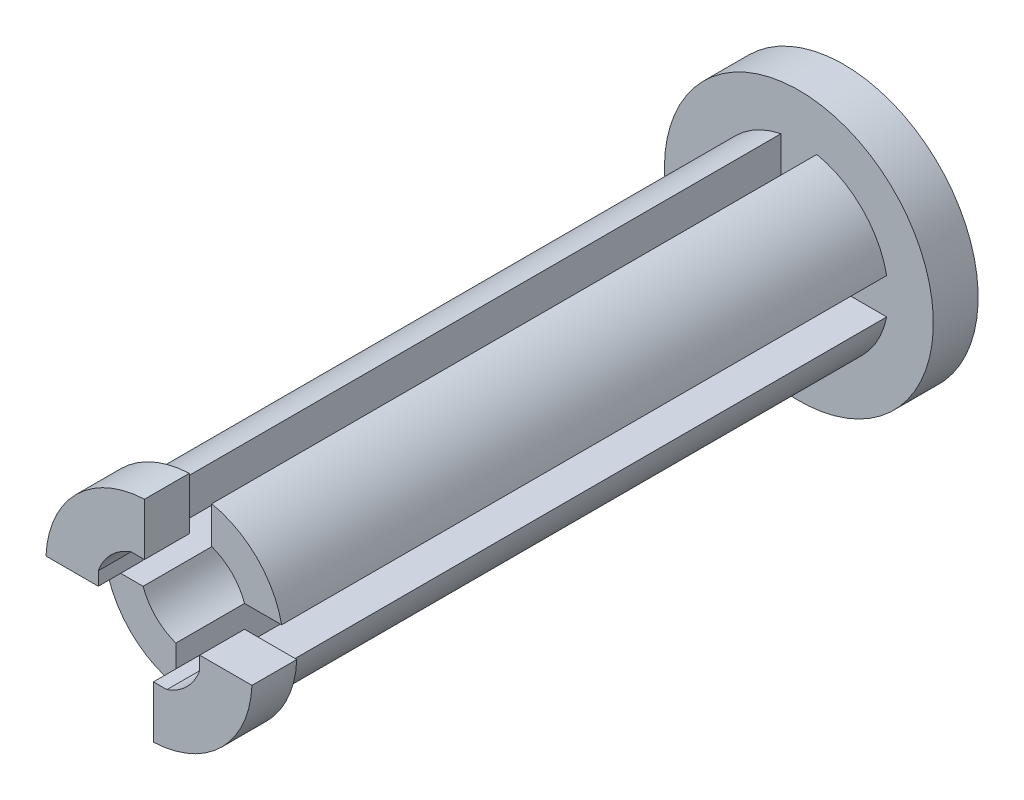
from build123d import *

# Parameters (mm, degrees)
SKETCH1_R           = 2
BOSS_EXTRUDE1_DEPTH = 13.5
SKETCH2_R           = 1.2
CUT_EXTRUDE1_DEPTH  = 14.793114224
SKETCH3_W           = 0.8
SKETCH3_H           = 6.59267807
SKETCH3_W_2         = 7.006923124
SKETCH3_H_2         = 0.8
CUT_EXTRUDE3_DEPTH  = 14.793114224
BOSS_EXTRUDE2_DEPTH = 1
SKETCH5_R           = 3
BOSS_EXTRUDE3_DEPTH = 1


with BuildPart() as part:
    # Sketch1 → Boss-Extrude1 (new body)
    with BuildSketch(Plane.XY):
        Circle(SKETCH1_R)
    extrude(amount=BOSS_EXTRUDE1_DEPTH)

    # Sketch2 → Cut-Extrude1 (cut, through all)
    with BuildSketch(Plane.XY.offset(13.5)):
        Circle(SKETCH2_R)
    extrude(amount=-CUT_EXTRUDE1_DEPTH, mode=Mode.SUBTRACT)

    # Sketch3 → Cut-Extrude3 (cut, through all)
    with BuildSketch(Plane.XY.offset(13.5)):
        Rectangle(SKETCH3_W, SKETCH3_H)
        Rectangle(SKETCH3_W_2, SKETCH3_H_2)
    extrude(amount=-CUT_EXTRUDE3_DEPTH, mode=Mode.SUBTRACT)


with BuildPart() as cut_extrude3_piece_1:
    # of the separate pieces the step leaves, piece 1, a body of its own (cut_extrude3_pieces)
    add(part.part.solids().sort_by_distance((1.959591794, 0.4, 0))[0])



with BuildPart() as cut_extrude3_piece_2:
    # of the separate pieces the step leaves, piece 2, a body of its own (cut_extrude3_pieces)
    add(part.part.solids().sort_by_distance((0.4, -1.959591794, 0))[0])



with BuildPart() as cut_extrude3_piece_3:
    # of the separate pieces the step leaves, piece 3, a body of its own (cut_extrude3_pieces)
    add(part.part.solids().sort_by_distance((-1.959591794, -0.4, 0))[0])


with BuildPart() as cut_extrude3_piece_4:
    # of the separate pieces the step leaves, piece 4, a body of its own (cut_extrude3_pieces)
    add(part.part.solids().sort_by_distance((-0.4, 1.959591794, 0))[0])


with BuildPart() as cut_extrude3_piece_2_1:
    add(cut_extrude3_piece_2.part)

    add(cut_extrude3_piece_4.part)  # Boss-Extrude2 merges Cut-Extrude3 piece 4
    # Sketch4 → Boss-Extrude2 (add)
    with BuildSketch(Plane.XY.offset(13.5)):
        with BuildLine():
            Line((-2.297825059, 0.1), (-1.13137085, 0.1))
            Line((-1.13137085, 0.1), (-1.13137085, 0.4))
            ThreePointArc((-1.13137085, 0.4), (-0.848528137, 0.848528137), (-0.4, 1.13137085))
            Line((-0.4, 1.13137085), (-0.1, 1.13137085))
            Line((-0.1, 1.13137085), (-0.1, 2.297825059))
            ThreePointArc((-0.1, 2.297825059), (-1.626345597, 1.626345597), (-2.297825059, 0.1))
        make_face()
        with BuildLine():
            Line((0.1, -1.13137085), (0.1, -2.297825059))
            ThreePointArc((0.1, -2.297825059), (1.626345597, -1.626345597), (2.297825059, -0.1))
            Line((2.297825059, -0.1), (1.13137085, -0.1))
            Line((1.13137085, -0.1), (1.13137085, -0.4))
            ThreePointArc((1.13137085, -0.4), (0.848528137, -0.848528137), (0.4, -1.13137085))
            Line((0.4, -1.13137085), (0.1, -1.13137085))
        make_face()
    extrude(amount=BOSS_EXTRUDE2_DEPTH)


with BuildPart() as cut_extrude3_piece_1_1:
    add(cut_extrude3_piece_1.part)

    add(cut_extrude3_piece_2_1.part)  # Boss-Extrude3 merges Cut-Extrude3 piece 2

    add(cut_extrude3_piece_3.part)  # Boss-Extrude3 merges Cut-Extrude3 piece 3
    # Sketch5 → Boss-Extrude3 (add)
    with BuildSketch(Plane(origin=(0, 0, 0), x_dir=(-1, 0, 0), z_dir=(0, 0, -1))):
        Circle(SKETCH5_R)
    extrude(amount=BOSS_EXTRUDE3_DEPTH)


solid = cut_extrude3_piece_1_1.part
